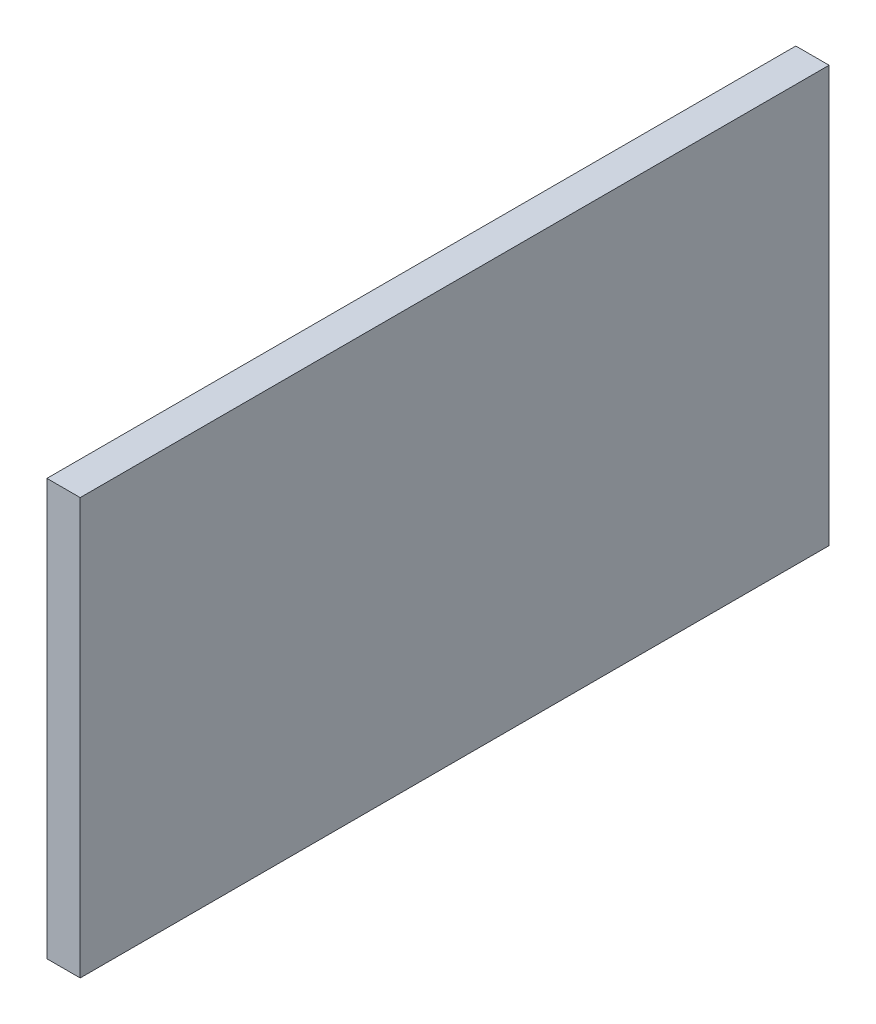
from build123d import *

# Parameters (mm, degrees)
SKETCH1_W           = 90
SKETCH1_H           = 50
BOSS_EXTRUDE1_DEPTH = 4


with BuildPart() as part:
    # Sketch1 → Boss-Extrude1 (new body)
    with BuildSketch(Plane(origin=(0, 0, 0), x_dir=(0, 0, -1), z_dir=(1, 0, 0))):
        with Locations((45, -25)):
            Rectangle(SKETCH1_W, SKETCH1_H)
    extrude(amount=BOSS_EXTRUDE1_DEPTH)


solid = part.part
